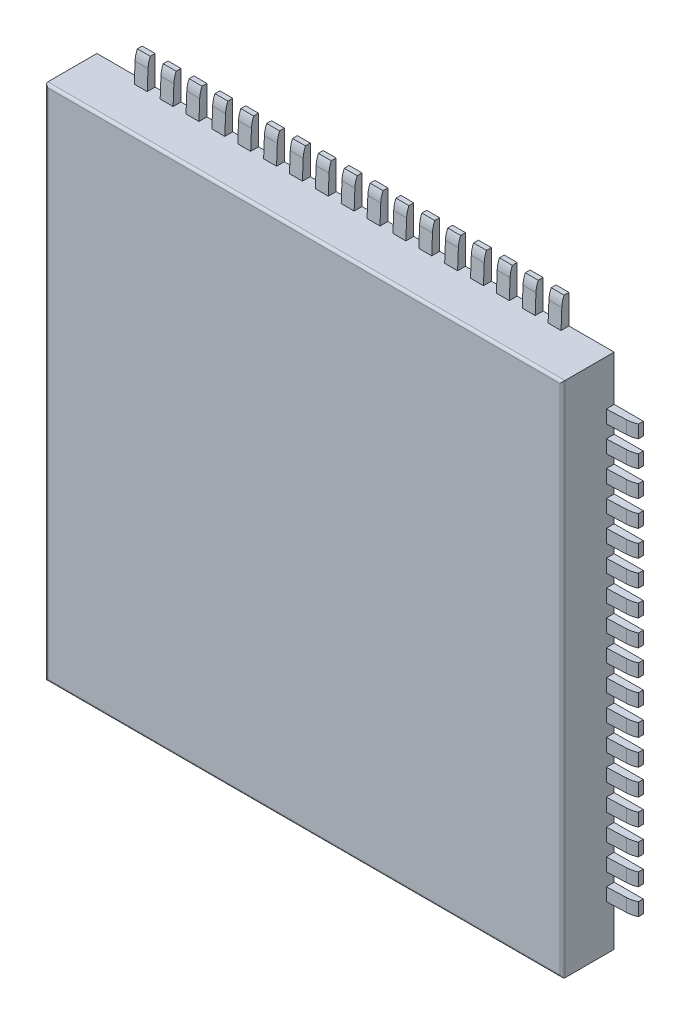
from build123d import *

# Parameters (mm, degrees)
SKETCH1_W           = 8
SKETCH1_H           = 8
BOSS_EXTRUDE1_DEPTH = 0.8
FILLET1_R           = 0.04
SKETCH3_W           = 0.2
SKETCH3_H           = 0.45
BOSS_EXTRUDE2_DEPTH = 0.15
CUT_EXTRUDE2_DEPTH  = 9.586763069
LPATTERN1_COUNT     = 17
LPATTERN1_PITCH     = 0.4
SKETCH5_R           = 2.5
BOSS_EXTRUDE3_DEPTH = 0.1
CIRPATTERN1_COUNT   = 4


with BuildPart() as part:
    # Sketch1 → Boss-Extrude1 (new body)
    with BuildSketch(Plane.XY):
        Rectangle(SKETCH1_W, SKETCH1_H)
    extrude(amount=BOSS_EXTRUDE1_DEPTH)

    # Fillet1
    fillet1_edges = [part.edges().sort_by_distance(p)[0] for p in [
        (4, 0, 0.8),
        (0, 4, 0.8),
        (-4, 0, 0.8),
        (0, -4, 0.8),
    ]]
    fillet(fillet1_edges, radius=FILLET1_R)


with BuildPart() as body_2:
    # Sketch3 → Boss-Extrude2 (new body)
    with BuildSketch(Plane(origin=(0, 0, 0), x_dir=(-1, 0, 0), z_dir=(0, 0, -1))):
        with Locations((3.2, -4.225)):
            Rectangle(SKETCH3_W, SKETCH3_H)
    extrude(amount=-BOSS_EXTRUDE2_DEPTH)

    # Sketch4 → Cut-Extrude2 (cut, through all)
    with BuildSketch(Plane.ZY.offset(3.3)):
        with BuildLine():
            Line((0.121893564, -4), (0.110154669, -4.301892387))
            ThreePointArc((0.110154669, -4.301892387), (0.099789952, -4.377658173), (0.075, -4.45))
            Line((0.075, -4.45), (0.272381791, -4.592230836))
            Line((0.272381791, -4.592230836), (0.293086267, -4))
            Line((0.293086267, -4), (0.121893564, -4))
        make_face()
    extrude(amount=-CUT_EXTRUDE2_DEPTH, mode=Mode.SUBTRACT)


with BuildPart() as lpattern1_1:
    # LPattern1: pattern copy
    add(body_2.part.moved(Location(Vector(1, 0, 0) * (1 * LPATTERN1_PITCH))))


with BuildPart() as lpattern1_2:
    # LPattern1: pattern copy
    add(body_2.part.moved(Location(Vector(1, 0, 0) * (2 * LPATTERN1_PITCH))))


with BuildPart() as lpattern1_3:
    # LPattern1: pattern copy
    add(body_2.part.moved(Location(Vector(1, 0, 0) * (3 * LPATTERN1_PITCH))))


with BuildPart() as lpattern1_4:
    # LPattern1: pattern copy
    add(body_2.part.moved(Location(Vector(1, 0, 0) * (4 * LPATTERN1_PITCH))))


with BuildPart() as lpattern1_5:
    # LPattern1: pattern copy
    add(body_2.part.moved(Location(Vector(1, 0, 0) * (5 * LPATTERN1_PITCH))))


with BuildPart() as lpattern1_6:
    # LPattern1: pattern copy
    add(body_2.part.moved(Location(Vector(1, 0, 0) * (6 * LPATTERN1_PITCH))))


with BuildPart() as lpattern1_7:
    # LPattern1: pattern copy
    add(body_2.part.moved(Location(Vector(1, 0, 0) * (7 * LPATTERN1_PITCH))))


with BuildPart() as lpattern1_8:
    # LPattern1: pattern copy
    add(body_2.part.moved(Location(Vector(1, 0, 0) * (8 * LPATTERN1_PITCH))))


with BuildPart() as lpattern1_9:
    # LPattern1: pattern copy
    add(body_2.part.moved(Location(Vector(1, 0, 0) * (9 * LPATTERN1_PITCH))))


with BuildPart() as lpattern1_10:
    # LPattern1: pattern copy
    add(body_2.part.moved(Location(Vector(1, 0, 0) * (10 * LPATTERN1_PITCH))))


with BuildPart() as lpattern1_11:
    # LPattern1: pattern copy
    add(body_2.part.moved(Location(Vector(1, 0, 0) * (11 * LPATTERN1_PITCH))))


with BuildPart() as lpattern1_12:
    # LPattern1: pattern copy
    add(body_2.part.moved(Location(Vector(1, 0, 0) * (12 * LPATTERN1_PITCH))))


with BuildPart() as lpattern1_13:
    # LPattern1: pattern copy
    add(body_2.part.moved(Location(Vector(1, 0, 0) * (13 * LPATTERN1_PITCH))))


with BuildPart() as lpattern1_14:
    # LPattern1: pattern copy
    add(body_2.part.moved(Location(Vector(1, 0, 0) * (14 * LPATTERN1_PITCH))))


with BuildPart() as lpattern1_15:
    # LPattern1: pattern copy
    add(body_2.part.moved(Location(Vector(1, 0, 0) * (15 * LPATTERN1_PITCH))))


with BuildPart() as lpattern1_16:
    # LPattern1: pattern copy
    add(body_2.part.moved(Location(Vector(1, 0, 0) * (16 * LPATTERN1_PITCH))))


with BuildPart() as body_19:
    # Sketch5 → Boss-Extrude3 (new body)
    with BuildSketch(Plane(origin=(0, 0, 0), x_dir=(-1, 0, 0), z_dir=(0, 0, -1))):
        Circle(SKETCH5_R)
    extrude(amount=BOSS_EXTRUDE3_DEPTH)


with BuildPart() as cirpattern1_1:
    # CirPattern1: pattern copy
    add(lpattern1_16.part.rotate(Axis((0, 0, 0), (0, 0, 1)), 1 * 360 / CIRPATTERN1_COUNT))


with BuildPart() as cirpattern1_2:
    # CirPattern1: pattern copy
    add(lpattern1_16.part.rotate(Axis((0, 0, 0), (0, 0, 1)), 2 * 360 / CIRPATTERN1_COUNT))


with BuildPart() as cirpattern1_3:
    # CirPattern1: pattern copy
    add(lpattern1_16.part.rotate(Axis((0, 0, 0), (0, 0, 1)), 3 * 360 / CIRPATTERN1_COUNT))


with BuildPart() as cirpattern1_4:
    # CirPattern1: pattern copy
    add(lpattern1_15.part.rotate(Axis((0, 0, 0), (0, 0, 1)), 1 * 360 / CIRPATTERN1_COUNT))


with BuildPart() as cirpattern1_5:
    # CirPattern1: pattern copy
    add(lpattern1_15.part.rotate(Axis((0, 0, 0), (0, 0, 1)), 2 * 360 / CIRPATTERN1_COUNT))


with BuildPart() as cirpattern1_6:
    # CirPattern1: pattern copy
    add(lpattern1_15.part.rotate(Axis((0, 0, 0), (0, 0, 1)), 3 * 360 / CIRPATTERN1_COUNT))


with BuildPart() as cirpattern1_7:
    # CirPattern1: pattern copy
    add(lpattern1_14.part.rotate(Axis((0, 0, 0), (0, 0, 1)), 1 * 360 / CIRPATTERN1_COUNT))


with BuildPart() as cirpattern1_8:
    # CirPattern1: pattern copy
    add(lpattern1_14.part.rotate(Axis((0, 0, 0), (0, 0, 1)), 2 * 360 / CIRPATTERN1_COUNT))


with BuildPart() as cirpattern1_9:
    # CirPattern1: pattern copy
    add(lpattern1_14.part.rotate(Axis((0, 0, 0), (0, 0, 1)), 3 * 360 / CIRPATTERN1_COUNT))


with BuildPart() as cirpattern1_10:
    # CirPattern1: pattern copy
    add(lpattern1_13.part.rotate(Axis((0, 0, 0), (0, 0, 1)), 1 * 360 / CIRPATTERN1_COUNT))


with BuildPart() as cirpattern1_11:
    # CirPattern1: pattern copy
    add(lpattern1_13.part.rotate(Axis((0, 0, 0), (0, 0, 1)), 2 * 360 / CIRPATTERN1_COUNT))


with BuildPart() as cirpattern1_12:
    # CirPattern1: pattern copy
    add(lpattern1_13.part.rotate(Axis((0, 0, 0), (0, 0, 1)), 3 * 360 / CIRPATTERN1_COUNT))


with BuildPart() as cirpattern1_13:
    # CirPattern1: pattern copy
    add(lpattern1_12.part.rotate(Axis((0, 0, 0), (0, 0, 1)), 1 * 360 / CIRPATTERN1_COUNT))


with BuildPart() as cirpattern1_14:
    # CirPattern1: pattern copy
    add(lpattern1_12.part.rotate(Axis((0, 0, 0), (0, 0, 1)), 2 * 360 / CIRPATTERN1_COUNT))


with BuildPart() as cirpattern1_15:
    # CirPattern1: pattern copy
    add(lpattern1_12.part.rotate(Axis((0, 0, 0), (0, 0, 1)), 3 * 360 / CIRPATTERN1_COUNT))


with BuildPart() as cirpattern1_16:
    # CirPattern1: pattern copy
    add(lpattern1_11.part.rotate(Axis((0, 0, 0), (0, 0, 1)), 1 * 360 / CIRPATTERN1_COUNT))


with BuildPart() as cirpattern1_17:
    # CirPattern1: pattern copy
    add(lpattern1_11.part.rotate(Axis((0, 0, 0), (0, 0, 1)), 2 * 360 / CIRPATTERN1_COUNT))


with BuildPart() as cirpattern1_18:
    # CirPattern1: pattern copy
    add(lpattern1_11.part.rotate(Axis((0, 0, 0), (0, 0, 1)), 3 * 360 / CIRPATTERN1_COUNT))


with BuildPart() as cirpattern1_19:
    # CirPattern1: pattern copy
    add(lpattern1_10.part.rotate(Axis((0, 0, 0), (0, 0, 1)), 1 * 360 / CIRPATTERN1_COUNT))


with BuildPart() as cirpattern1_20:
    # CirPattern1: pattern copy
    add(lpattern1_10.part.rotate(Axis((0, 0, 0), (0, 0, 1)), 2 * 360 / CIRPATTERN1_COUNT))


with BuildPart() as cirpattern1_21:
    # CirPattern1: pattern copy
    add(lpattern1_10.part.rotate(Axis((0, 0, 0), (0, 0, 1)), 3 * 360 / CIRPATTERN1_COUNT))


with BuildPart() as cirpattern1_22:
    # CirPattern1: pattern copy
    add(lpattern1_9.part.rotate(Axis((0, 0, 0), (0, 0, 1)), 1 * 360 / CIRPATTERN1_COUNT))


with BuildPart() as cirpattern1_23:
    # CirPattern1: pattern copy
    add(lpattern1_9.part.rotate(Axis((0, 0, 0), (0, 0, 1)), 2 * 360 / CIRPATTERN1_COUNT))


with BuildPart() as cirpattern1_24:
    # CirPattern1: pattern copy
    add(lpattern1_9.part.rotate(Axis((0, 0, 0), (0, 0, 1)), 3 * 360 / CIRPATTERN1_COUNT))


with BuildPart() as cirpattern1_25:
    # CirPattern1: pattern copy
    add(body_2.part.rotate(Axis((0, 0, 0), (0, 0, 1)), 1 * 360 / CIRPATTERN1_COUNT))


with BuildPart() as cirpattern1_26:
    # CirPattern1: pattern copy
    add(body_2.part.rotate(Axis((0, 0, 0), (0, 0, 1)), 2 * 360 / CIRPATTERN1_COUNT))


with BuildPart() as cirpattern1_27:
    # CirPattern1: pattern copy
    add(body_2.part.rotate(Axis((0, 0, 0), (0, 0, 1)), 3 * 360 / CIRPATTERN1_COUNT))


with BuildPart() as cirpattern1_28:
    # CirPattern1: pattern copy
    add(lpattern1_1.part.rotate(Axis((0, 0, 0), (0, 0, 1)), 1 * 360 / CIRPATTERN1_COUNT))


with BuildPart() as cirpattern1_29:
    # CirPattern1: pattern copy
    add(lpattern1_1.part.rotate(Axis((0, 0, 0), (0, 0, 1)), 2 * 360 / CIRPATTERN1_COUNT))


with BuildPart() as cirpattern1_30:
    # CirPattern1: pattern copy
    add(lpattern1_1.part.rotate(Axis((0, 0, 0), (0, 0, 1)), 3 * 360 / CIRPATTERN1_COUNT))


with BuildPart() as cirpattern1_31:
    # CirPattern1: pattern copy
    add(lpattern1_2.part.rotate(Axis((0, 0, 0), (0, 0, 1)), 1 * 360 / CIRPATTERN1_COUNT))


with BuildPart() as cirpattern1_32:
    # CirPattern1: pattern copy
    add(lpattern1_2.part.rotate(Axis((0, 0, 0), (0, 0, 1)), 2 * 360 / CIRPATTERN1_COUNT))


with BuildPart() as cirpattern1_33:
    # CirPattern1: pattern copy
    add(lpattern1_2.part.rotate(Axis((0, 0, 0), (0, 0, 1)), 3 * 360 / CIRPATTERN1_COUNT))


with BuildPart() as cirpattern1_34:
    # CirPattern1: pattern copy
    add(lpattern1_3.part.rotate(Axis((0, 0, 0), (0, 0, 1)), 1 * 360 / CIRPATTERN1_COUNT))


with BuildPart() as cirpattern1_35:
    # CirPattern1: pattern copy
    add(lpattern1_3.part.rotate(Axis((0, 0, 0), (0, 0, 1)), 2 * 360 / CIRPATTERN1_COUNT))


with BuildPart() as cirpattern1_36:
    # CirPattern1: pattern copy
    add(lpattern1_3.part.rotate(Axis((0, 0, 0), (0, 0, 1)), 3 * 360 / CIRPATTERN1_COUNT))


with BuildPart() as cirpattern1_37:
    # CirPattern1: pattern copy
    add(lpattern1_4.part.rotate(Axis((0, 0, 0), (0, 0, 1)), 1 * 360 / CIRPATTERN1_COUNT))


with BuildPart() as cirpattern1_38:
    # CirPattern1: pattern copy
    add(lpattern1_4.part.rotate(Axis((0, 0, 0), (0, 0, 1)), 2 * 360 / CIRPATTERN1_COUNT))


with BuildPart() as cirpattern1_39:
    # CirPattern1: pattern copy
    add(lpattern1_4.part.rotate(Axis((0, 0, 0), (0, 0, 1)), 3 * 360 / CIRPATTERN1_COUNT))


with BuildPart() as cirpattern1_40:
    # CirPattern1: pattern copy
    add(lpattern1_5.part.rotate(Axis((0, 0, 0), (0, 0, 1)), 1 * 360 / CIRPATTERN1_COUNT))


with BuildPart() as cirpattern1_41:
    # CirPattern1: pattern copy
    add(lpattern1_5.part.rotate(Axis((0, 0, 0), (0, 0, 1)), 2 * 360 / CIRPATTERN1_COUNT))


with BuildPart() as cirpattern1_42:
    # CirPattern1: pattern copy
    add(lpattern1_5.part.rotate(Axis((0, 0, 0), (0, 0, 1)), 3 * 360 / CIRPATTERN1_COUNT))


with BuildPart() as cirpattern1_43:
    # CirPattern1: pattern copy
    add(lpattern1_6.part.rotate(Axis((0, 0, 0), (0, 0, 1)), 1 * 360 / CIRPATTERN1_COUNT))


with BuildPart() as cirpattern1_44:
    # CirPattern1: pattern copy
    add(lpattern1_6.part.rotate(Axis((0, 0, 0), (0, 0, 1)), 2 * 360 / CIRPATTERN1_COUNT))


with BuildPart() as cirpattern1_45:
    # CirPattern1: pattern copy
    add(lpattern1_6.part.rotate(Axis((0, 0, 0), (0, 0, 1)), 3 * 360 / CIRPATTERN1_COUNT))


with BuildPart() as cirpattern1_46:
    # CirPattern1: pattern copy
    add(lpattern1_7.part.rotate(Axis((0, 0, 0), (0, 0, 1)), 1 * 360 / CIRPATTERN1_COUNT))


with BuildPart() as cirpattern1_47:
    # CirPattern1: pattern copy
    add(lpattern1_7.part.rotate(Axis((0, 0, 0), (0, 0, 1)), 2 * 360 / CIRPATTERN1_COUNT))


with BuildPart() as cirpattern1_48:
    # CirPattern1: pattern copy
    add(lpattern1_7.part.rotate(Axis((0, 0, 0), (0, 0, 1)), 3 * 360 / CIRPATTERN1_COUNT))


with BuildPart() as cirpattern1_49:
    # CirPattern1: pattern copy
    add(lpattern1_8.part.rotate(Axis((0, 0, 0), (0, 0, 1)), 1 * 360 / CIRPATTERN1_COUNT))


with BuildPart() as cirpattern1_50:
    # CirPattern1: pattern copy
    add(lpattern1_8.part.rotate(Axis((0, 0, 0), (0, 0, 1)), 2 * 360 / CIRPATTERN1_COUNT))


with BuildPart() as cirpattern1_51:
    # CirPattern1: pattern copy
    add(lpattern1_8.part.rotate(Axis((0, 0, 0), (0, 0, 1)), 3 * 360 / CIRPATTERN1_COUNT))


solid = Compound([part.part, body_2.part, lpattern1_1.part, lpattern1_2.part, lpattern1_3.part, lpattern1_4.part, lpattern1_5.part, lpattern1_6.part, lpattern1_7.part, lpattern1_8.part, lpattern1_9.part, lpattern1_10.part, lpattern1_11.part, lpattern1_12.part, lpattern1_13.part, lpattern1_14.part, lpattern1_15.part, lpattern1_16.part, body_19.part, cirpattern1_1.part, cirpattern1_2.part, cirpattern1_3.part, cirpattern1_4.part, cirpattern1_5.part, cirpattern1_6.part, cirpattern1_7.part, cirpattern1_8.part, cirpattern1_9.part, cirpattern1_10.part, cirpattern1_11.part, cirpattern1_12.part, cirpattern1_13.part, cirpattern1_14.part, cirpattern1_15.part, cirpattern1_16.part, cirpattern1_17.part, cirpattern1_18.part, cirpattern1_19.part, cirpattern1_20.part, cirpattern1_21.part, cirpattern1_22.part, cirpattern1_23.part, cirpattern1_24.part, cirpattern1_25.part, cirpattern1_26.part, cirpattern1_27.part, cirpattern1_28.part, cirpattern1_29.part, cirpattern1_30.part, cirpattern1_31.part, cirpattern1_32.part, cirpattern1_33.part, cirpattern1_34.part, cirpattern1_35.part, cirpattern1_36.part, cirpattern1_37.part, cirpattern1_38.part, cirpattern1_39.part, cirpattern1_40.part, cirpattern1_41.part, cirpattern1_42.part, cirpattern1_43.part, cirpattern1_44.part, cirpattern1_45.part, cirpattern1_46.part, cirpattern1_47.part, cirpattern1_48.part, cirpattern1_49.part, cirpattern1_50.part, cirpattern1_51.part])
